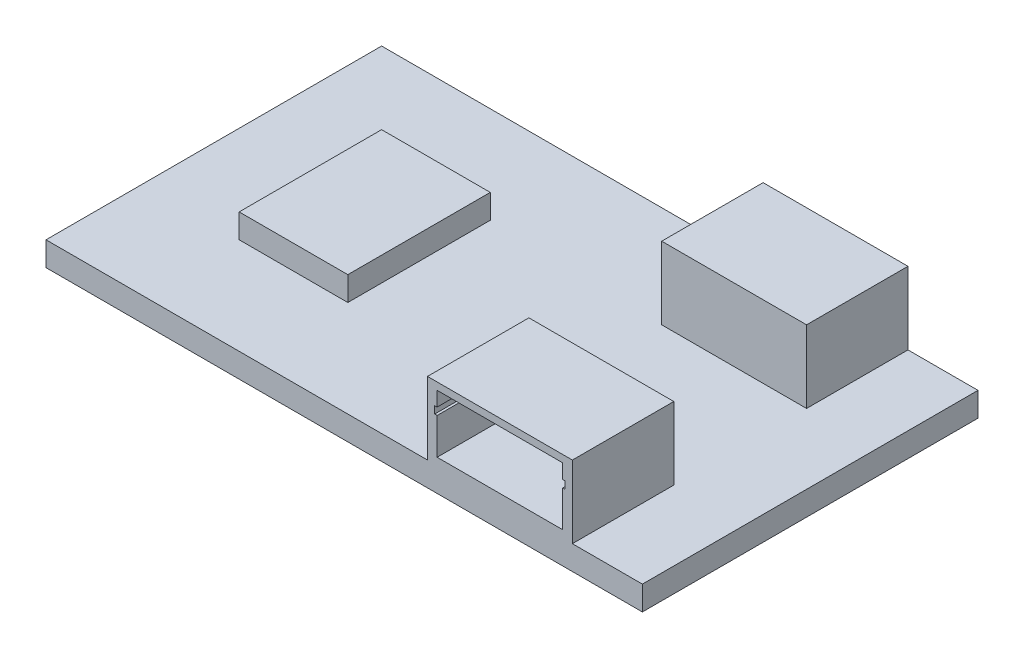
from build123d import *

# Parameters (mm, degrees)
SKETCH1_W           = 24.7
SKETCH1_H           = 13.9
BOSS_EXTRUDE1_DEPTH = 1
SKETCH2_W           = 6
SKETCH2_H           = 4.2
BOSS_EXTRUDE2_DEPTH = 3
CUT_EXTRUDE1_DEPTH  = 3
CUT_EXTRUDE2_DEPTH  = 3
SKETCH6_W           = 4.5
SKETCH6_H           = 5.9
BOSS_EXTRUDE3_DEPTH = 1


with BuildPart() as part:
    # Sketch1 → Boss-Extrude1 (new body)
    with BuildSketch(Plane(origin=(0, 0, 0), x_dir=(1, 0, 0), z_dir=(0, 1, 0))):
        Rectangle(SKETCH1_W, SKETCH1_H)
    extrude(amount=BOSS_EXTRUDE1_DEPTH)

    # Sketch2 → Boss-Extrude2 (add)
    with BuildSketch(Plane(origin=(0, 1, 0), x_dir=(1, 0, 0), z_dir=(0, 1, 0))):
        with Locations((6.45, -4.85)):
            Rectangle(SKETCH2_W, SKETCH2_H)
        with Locations((6.45, 4.85)):
            Rectangle(SKETCH2_W, SKETCH2_H)
    extrude(amount=BOSS_EXTRUDE2_DEPTH)

    # Sketch3 → Cut-Extrude1 (cut)
    with BuildSketch(Plane.XY.offset(6.95)):
        Polygon((3.85, 3.7), (3.85, 3.1), (3.75, 3.1), (3.75, 2.8), (3.85, 2.8), (3.85, 1.3), (9.05, 1.3), (9.05, 2.8), (9.15, 2.8), (9.15, 3.1), (9.05, 3.1), (9.05, 3.7), align=None)
    extrude(amount=-CUT_EXTRUDE1_DEPTH, mode=Mode.SUBTRACT)

    # Sketch5 → Cut-Extrude2 (cut)
    with BuildSketch(Plane(origin=(0, 0, -6.95), x_dir=(-1, 0, 0), z_dir=(0, 0, -1))):
        Polygon((-9.15, 3.7), (-9.15, 3.1), (-9.25, 3.1), (-9.25, 2.8), (-9.15, 2.8), (-9.15, 1.3), (-3.75, 1.3), (-3.75, 2.8), (-3.65, 2.8), (-3.65, 3.1), (-3.75, 3.1), (-3.75, 3.7), align=None)
    extrude(amount=-CUT_EXTRUDE2_DEPTH, mode=Mode.SUBTRACT)

    # Sketch6 → Boss-Extrude3 (add)
    with BuildSketch(Plane(origin=(0, 1, 0), x_dir=(1, 0, 0), z_dir=(0, 1, 0))):
        with Locations((-6.1, 0)):
            Rectangle(SKETCH6_W, SKETCH6_H)
    extrude(amount=BOSS_EXTRUDE3_DEPTH)


solid = part.part
